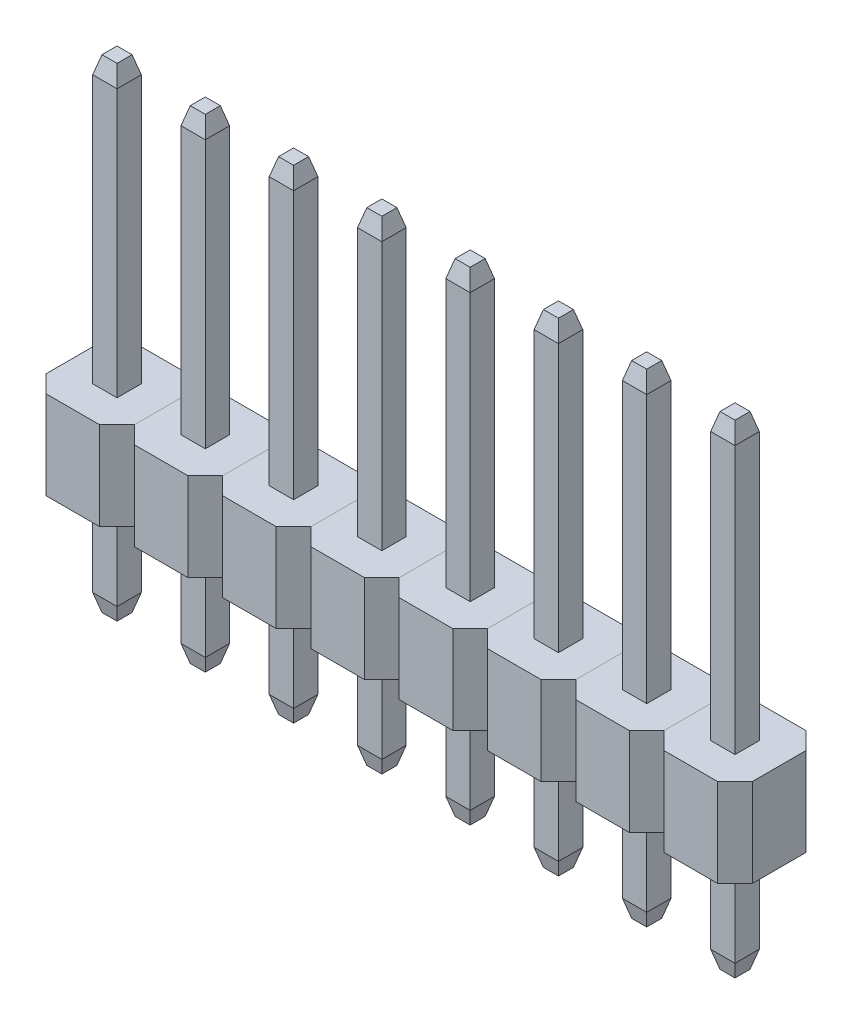
from build123d import *

# Parameters (mm, degrees)
SKETCH3_W           = 2.54
SKETCH3_H           = 2.54
SKETCH3_W_2         = 0.635
SKETCH3_H_2         = 0.635
BOSS_EXTRUDE1_DEPTH = 1.27
CHAMFER1_SIZE       = 0.5
BOSS_EXTRUDE2_START = -5.2
SKETCH5_W           = 0.7
SKETCH5_H           = 0.7
BOSS_EXTRUDE2_DEPTH = 12.9
SKETCH6_W           = 0.7
SKETCH6_H           = 0.7
BOSS_EXTRUDE3_DEPTH = 0.5
BOSS_EXTRUDE3_TAPER = 15
SKETCH7_W           = 0.7
SKETCH7_H           = 0.7
BOSS_EXTRUDE4_DEPTH = 0.5
BOSS_EXTRUDE4_TAPER = 15
LPATTERN1_COUNT     = 8
LPATTERN1_PITCH     = 2.54


with BuildPart() as part:
    # Sketch3 → Boss-Extrude1 (new, symmetric)
    with BuildSketch(Plane(origin=(0, 0, 0), x_dir=(1, 0, 0), z_dir=(0, 1, 0))):
        Rectangle(SKETCH3_W, SKETCH3_H)
        Rectangle(SKETCH3_W_2, SKETCH3_H_2, mode=Mode.SUBTRACT)
    extrude(amount=BOSS_EXTRUDE1_DEPTH, both=True)

    # Chamfer1
    chamfer1_edges = [part.edges().sort_by_distance(p)[0] for p in [
        (1.27, 0, 1.27),
        (-1.27, 0, 1.27),
        (-1.27, 0, -1.27),
        (1.27, 0, -1.27),
    ]]
    chamfer(chamfer1_edges, length=CHAMFER1_SIZE)


with BuildPart() as body_2:
    # Sketch5 → Boss-Extrude2 (new body)
    with BuildSketch(Plane(origin=(0, 1.27, 0), x_dir=(1, 0, 0), z_dir=(0, 1, 0)).offset(BOSS_EXTRUDE2_START)):
        Rectangle(SKETCH5_W, SKETCH5_H)
    extrude(amount=BOSS_EXTRUDE2_DEPTH)

    # Sketch6 → Boss-Extrude3 (add)
    with BuildSketch(Plane(origin=(0, 8.97, 0), x_dir=(1, 0, 0), z_dir=(0, 1, 0))):
        Rectangle(SKETCH6_W, SKETCH6_H)
    extrude(amount=BOSS_EXTRUDE3_DEPTH, taper=BOSS_EXTRUDE3_TAPER)

    # Sketch7 → Boss-Extrude4 (add)
    with BuildSketch(Plane.XZ.offset(3.93)):
        Rectangle(SKETCH7_W, SKETCH7_H)
    extrude(amount=BOSS_EXTRUDE4_DEPTH, taper=BOSS_EXTRUDE4_TAPER)


with BuildPart() as lpattern1_1:
    # LPattern1: pattern copy
    add(part.part.moved(Location(Vector(1, 0, 0) * (1 * LPATTERN1_PITCH))))


with BuildPart() as lpattern1_2:
    # LPattern1: pattern copy
    add(part.part.moved(Location(Vector(1, 0, 0) * (2 * LPATTERN1_PITCH))))


with BuildPart() as lpattern1_3:
    # LPattern1: pattern copy
    add(part.part.moved(Location(Vector(1, 0, 0) * (3 * LPATTERN1_PITCH))))


with BuildPart() as lpattern1_4:
    # LPattern1: pattern copy
    add(part.part.moved(Location(Vector(1, 0, 0) * (4 * LPATTERN1_PITCH))))


with BuildPart() as lpattern1_5:
    # LPattern1: pattern copy
    add(part.part.moved(Location(Vector(1, 0, 0) * (5 * LPATTERN1_PITCH))))


with BuildPart() as lpattern1_6:
    # LPattern1: pattern copy
    add(part.part.moved(Location(Vector(1, 0, 0) * (6 * LPATTERN1_PITCH))))


with BuildPart() as lpattern1_7:
    # LPattern1: pattern copy
    add(part.part.moved(Location(Vector(1, 0, 0) * (7 * LPATTERN1_PITCH))))


with BuildPart() as lpattern1_8:
    # LPattern1: pattern copy
    add(body_2.part.moved(Location(Vector(1, 0, 0) * (1 * LPATTERN1_PITCH))))


with BuildPart() as lpattern1_9:
    # LPattern1: pattern copy
    add(body_2.part.moved(Location(Vector(1, 0, 0) * (2 * LPATTERN1_PITCH))))


with BuildPart() as lpattern1_10:
    # LPattern1: pattern copy
    add(body_2.part.moved(Location(Vector(1, 0, 0) * (3 * LPATTERN1_PITCH))))


with BuildPart() as lpattern1_11:
    # LPattern1: pattern copy
    add(body_2.part.moved(Location(Vector(1, 0, 0) * (4 * LPATTERN1_PITCH))))


with BuildPart() as lpattern1_12:
    # LPattern1: pattern copy
    add(body_2.part.moved(Location(Vector(1, 0, 0) * (5 * LPATTERN1_PITCH))))


with BuildPart() as lpattern1_13:
    # LPattern1: pattern copy
    add(body_2.part.moved(Location(Vector(1, 0, 0) * (6 * LPATTERN1_PITCH))))


with BuildPart() as lpattern1_14:
    # LPattern1: pattern copy
    add(body_2.part.moved(Location(Vector(1, 0, 0) * (7 * LPATTERN1_PITCH))))


solid = Compound([part.part, body_2.part, lpattern1_1.part, lpattern1_2.part, lpattern1_3.part, lpattern1_4.part, lpattern1_5.part, lpattern1_6.part, lpattern1_7.part, lpattern1_8.part, lpattern1_9.part, lpattern1_10.part, lpattern1_11.part, lpattern1_12.part, lpattern1_13.part, lpattern1_14.part])
